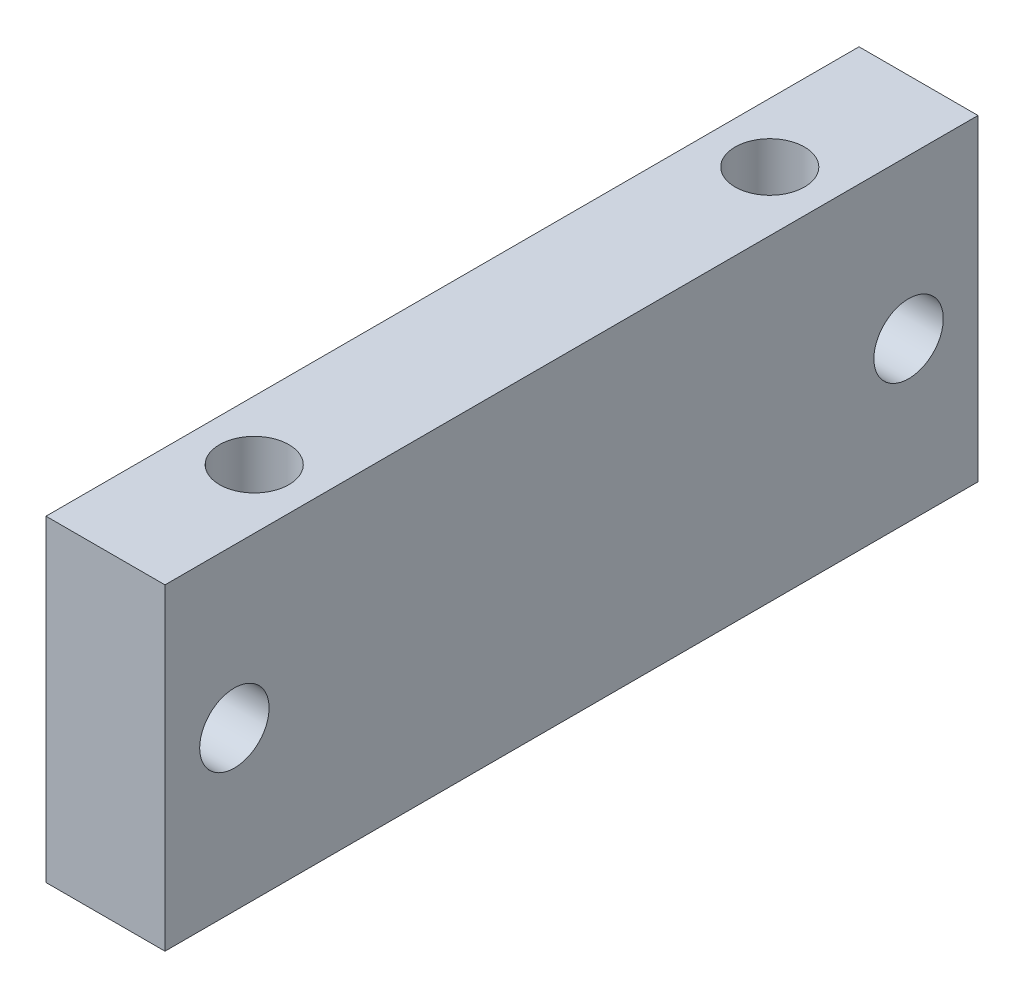
from build123d import *

# Parameters (mm, degrees)
SKETCH_1_W          = 6
SKETCH_1_H          = 41
EXTRUDE_1_DEPTH     = 16
SKETCH_2_R          = 1.75
CUT_EXTRUDE_1_DEPTH = 27.177280225
SKETCH_3_R          = 1.75
CUT_EXTRUDE_2_DEPTH = 27.68801229


with BuildPart() as part:
    # 草图1 → 凸台-拉伸1 (new body)
    with BuildSketch(Plane(origin=(0, 0, 0), x_dir=(1, 0, 0), z_dir=(0, 1, 0))):
        Rectangle(SKETCH_1_W, SKETCH_1_H)
    extrude(amount=EXTRUDE_1_DEPTH)

    # 草图2 → 切除-拉伸1 (cut, through all)
    with BuildSketch(Plane(origin=(0, 16, 0), x_dir=(1, 0, 0), z_dir=(0, 1, 0))):
        with Locations(Location((0, 13, 0), (0, 0, 270))):
            Circle(SKETCH_2_R)
        with Locations(Location((0, -13, 0), (0, 0, 270))):
            Circle(SKETCH_2_R)
    extrude(amount=-CUT_EXTRUDE_1_DEPTH, mode=Mode.SUBTRACT)

    # 草图3 → 切除-拉伸2 (cut, through all)
    with BuildSketch(Plane.ZY.offset(3)):
        with Locations((-17, 8)):
            Circle(SKETCH_3_R)
        with Locations((17, 8)):
            Circle(SKETCH_3_R)
    extrude(amount=-CUT_EXTRUDE_2_DEPTH, mode=Mode.SUBTRACT)


solid = part.part
